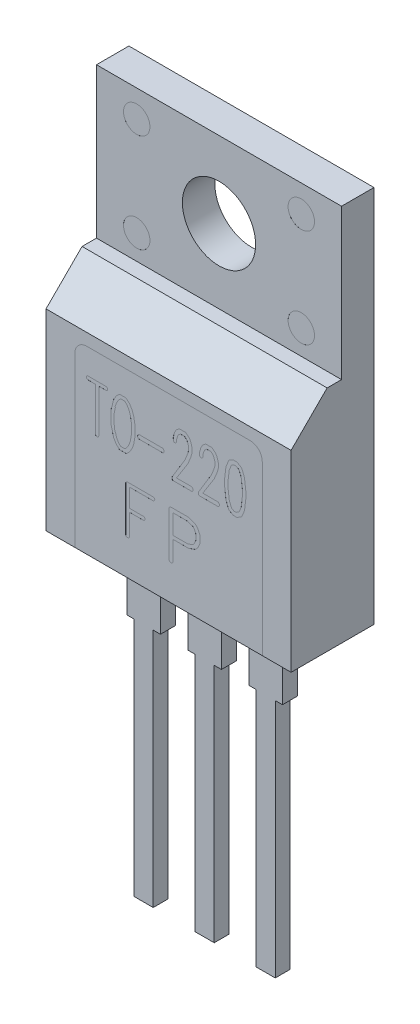
from build123d import *

# Parameters (mm, degrees)
SKETCH1_W           = 10.2
SKETCH1_H           = 15.75
SKETCH1_R           = 1.525
BOSS_EXTRUDE1_DEPTH = 1.35
SKETCH2_W           = 10.2
SKETCH2_H           = 9.5
BOSS_EXTRUDE2_DEPTH = 2.1
CHAMFER1_SIZE       = 1.5
CUT_EXTRUDE1_DEPTH  = 0.001
SKETCH4_W           = 1.4
SKETCH4_H           = 0.62
BOSS_EXTRUDE3_DEPTH = 2.85
SKETCH5_W           = 0.8
SKETCH5_H           = 0.62
BOSS_EXTRUDE4_DEPTH = 10
CUT_EXTRUDE2_DEPTH  = 0.001
SKETCH7_R           = 0.55
CUT_EXTRUDE3_DEPTH  = 0.001


with BuildPart() as part:
    # Sketch1 → Boss-Extrude1 (new body)
    with BuildSketch(Plane.XY):
        Rectangle(SKETCH1_W, SKETCH1_H)
        with Locations((0, 4.7)):
            Circle(SKETCH1_R, mode=Mode.SUBTRACT)
    extrude(amount=BOSS_EXTRUDE1_DEPTH)

    # Sketch2 → Boss-Extrude2 (add)
    with BuildSketch(Plane.XY.offset(1.35)):
        with Locations((0, -3.125)):
            Rectangle(SKETCH2_W, SKETCH2_H)
    extrude(amount=BOSS_EXTRUDE2_DEPTH)

    # Chamfer1
    chamfer1_edges = [part.edges().sort_by_distance(p)[0] for p in [
        (0, 1.625, 3.45),
    ]]
    chamfer(chamfer1_edges, length=CHAMFER1_SIZE)

    # Sketch3 → Cut-Extrude1 (cut)
    with BuildSketch(Plane.XY.offset(3.45)):
        with BuildLine():
            Line((-3.9, -7.875), (3.9, -7.875))
            Line((3.9, -7.875), (3.9, -0.875))
            ThreePointArc((3.9, -0.875), (3.753553391, -0.521446609), (3.4, -0.375))
            Line((3.4, -0.375), (-3.4, -0.375))
            ThreePointArc((-3.4, -0.375), (-3.753553391, -0.521446609), (-3.9, -0.875))
            Line((-3.9, -0.875), (-3.9, -7.875))
        make_face()
    extrude(amount=-CUT_EXTRUDE1_DEPTH, mode=Mode.SUBTRACT)

    # Sketch4 → Boss-Extrude3 (add)
    with BuildSketch(Plane.XZ.offset(7.875)):
        with Locations((-2.54, 1.639)):
            Rectangle(SKETCH4_W, SKETCH4_H)
        with Locations((0, 1.639)):
            Rectangle(SKETCH4_W, SKETCH4_H)
        with Locations((2.54, 1.639)):
            Rectangle(SKETCH4_W, SKETCH4_H)
    extrude(amount=BOSS_EXTRUDE3_DEPTH)

    # Sketch5 → Boss-Extrude4 (add)
    with BuildSketch(Plane.XZ.offset(10.725)):
        with Locations((-2.54, 1.639)):
            Rectangle(SKETCH5_W, SKETCH5_H)
        with Locations((2.54, 1.639)):
            Rectangle(SKETCH5_W, SKETCH5_H)
        with Locations((0, 1.639)):
            Rectangle(SKETCH5_W, SKETCH5_H)
    extrude(amount=BOSS_EXTRUDE4_DEPTH)

    # Sketch6 → Cut-Extrude2 (cut)
    # profile 1 of 8: a face of its own
    with BuildSketch(Plane.XY.offset(3.449)):
        with BuildLine():
            add(Edge.make_bspline(
                [(-3.337053571, -1.553571429), (-3.344583859, -1.555083796), (-3.358084631, -1.557795263), (-3.376927269, -1.557912121), (-3.392215813, -1.553387595), (-3.405362186, -1.540412883), (-3.414351272, -1.519967594), (-3.41589508, -1.502685243), (-3.416666667, -1.494047619)],
                knots=[0, 0, 0, 0, 1.138141606, 2.040531624, 2.780009125, 3.431502412, 4.71627916, 6, 6, 6, 6], degree=3))
            add(Edge.make_bspline(
                [(-3.416666667, -1.494047619), (-3.415955255, -1.485487162), (-3.414521596, -1.468235861), (-3.404666849, -1.448597093), (-3.394260846, -1.435081439), (-3.38431118, -1.427810635), (-3.37298055, -1.423460993), (-3.36499444, -1.422906102), (-3.360863095, -1.422619048)],
                knots=[0, 0, 0, 0, 1.528507809, 3.080296578, 3.85483527, 4.570982135, 5.260745705, 6, 6, 6, 6], degree=3))
            Line((-3.360863095, -1.422619048), (-2.613467262, -1.422619048))
            add(Edge.make_bspline(
                [(-2.613467262, -1.422619048), (-2.606485162, -1.422815125), (-2.59355828, -1.423178148), (-2.575825567, -1.428053473), (-2.561244351, -1.436313287), (-2.548533817, -1.451534048), (-2.537353697, -1.470515), (-2.535182119, -1.48685483), (-2.53422619, -1.494047619)],
                knots=[0, 0, 0, 0, 1.05057451, 1.945067327, 2.750578307, 3.532262753, 4.913702687, 6, 6, 6, 6], degree=3))
            add(Edge.make_bspline(
                [(-2.53422619, -1.494047619), (-2.535175637, -1.501359799), (-2.537312403, -1.517816137), (-2.548355556, -1.536974442), (-2.56138378, -1.551775043), (-2.575807789, -1.560057824), (-2.593563867, -1.564912043), (-2.606487122, -1.565278344), (-2.613467262, -1.56547619)],
                knots=[0, 0, 0, 0, 1.103831219, 2.484213998, 3.251526589, 4.056421147, 4.950229448, 6, 6, 6, 6], degree=3))
            Line((-2.613467262, -1.56547619), (-2.904761905, -1.56547619))
            Line((-2.904761905, -1.56547619), (-2.904761905, -3.345238095))
            add(Edge.make_bspline(
                [(-2.904761905, -3.345238095), (-2.905783203, -3.353312761), (-2.908067564, -3.371373542), (-2.920112704, -3.39210117), (-2.93369168, -3.4082686), (-2.948913179, -3.41688488), (-2.967479812, -3.421576529), (-2.980872483, -3.422253794), (-2.988095238, -3.422619048)],
                knots=[0, 0, 0, 0, 1.142200586, 2.554785099, 3.31231341, 4.106525294, 4.978836614, 6, 6, 6, 6], degree=3))
            add(Edge.make_bspline(
                [(-2.988095238, -3.422619048), (-2.992477514, -3.422356854), (-3.000994974, -3.421847252), (-3.012982756, -3.417136995), (-3.023333729, -3.409295729), (-3.035092846, -3.395314638), (-3.0451181, -3.373493005), (-3.046786339, -3.354645774), (-3.047619048, -3.345238095)],
                knots=[0, 0, 0, 0, 0.726822302, 1.412663379, 2.105912496, 2.866784857, 4.436041716, 6, 6, 6, 6], degree=3))
            Line((-3.047619048, -3.345238095), (-3.047619048, -1.56547619))
            Line((-3.047619048, -1.56547619), (-3.313244048, -1.56547619))
            Line((-3.313244048, -1.56547619), (-3.337053571, -1.553571429))
        make_face()
    # profile 2 of 8: a face of its own
    with BuildSketch(Plane.XY.offset(3.449)):
        with BuildLine():
            add(Edge.make_bspline(
                [(-1.52641369, -1.713541667), (-1.521569557, -1.721139903), (-1.513281033, -1.734140818), (-1.509417878, -1.749023616), (-1.5078125, -1.755208333)],
                knots=[0, 0, 0, 0, 1.168877111, 2, 2, 2, 2], degree=3))
            Line((-1.5078125, -1.755208333), (-1.45610119, -1.905505952))
            Line((-1.45610119, -1.905505952), (-1.453869048, -1.909970238))
            add(Edge.make_bspline(
                [(-1.453869048, -1.909970238), (-1.452063818, -1.915881011), (-1.449118709, -1.925524034), (-1.447715658, -1.935499284), (-1.447172619, -1.939360119)],
                knots=[0, 0, 0, 0, 1.225917069, 2, 2, 2, 2], degree=3))
            Line((-1.447172619, -1.939360119), (-1.405133929, -2.181547619))
            add(Edge.make_bspline(
                [(-1.405133929, -2.181547619), (-1.404978098, -2.186383521), (-1.404674476, -2.195805821), (-1.404733281, -2.205232768), (-1.404761905, -2.209821429)],
                knots=[0, 0, 0, 0, 1.026479987, 2, 2, 2, 2], degree=3))
            Line((-1.404761905, -2.209821429), (-1.404761905, -2.635416667))
            add(Edge.make_bspline(
                [(-1.404761905, -2.635416667), (-1.404761905, -2.640252976), (-1.404761905, -2.648933532), (-1.404761905, -2.657614087), (-1.404761905, -2.661458333)],
                knots=[0, 0, 0, 0, 1.114285714, 2, 2, 2, 2], degree=3))
            Line((-1.404761905, -2.661458333), (-1.447544643, -2.911458333))
            add(Edge.make_bspline(
                [(-1.447544643, -2.911458333), (-1.448071758, -2.915076164), (-1.44923368, -2.923050959), (-1.451750148, -2.930710891), (-1.453125, -2.934895833)],
                knots=[0, 0, 0, 0, 0.907316161, 2, 2, 2, 2], degree=3))
            Line((-1.453125, -2.934895833), (-1.453497024, -2.936755952))
            Line((-1.453497024, -2.936755952), (-1.509672619, -3.099702381))
            add(Edge.make_bspline(
                [(-1.509672619, -3.099702381), (-1.511691149, -3.105142077), (-1.515068691, -3.114244148), (-1.520240473, -3.122444496), (-1.522321429, -3.125744048)],
                knots=[0, 0, 0, 0, 1.195265482, 2, 2, 2, 2], degree=3))
            Line((-1.522321429, -3.125744048), (-1.624255952, -3.292782738))
            add(Edge.make_bspline(
                [(-1.624255952, -3.292782738), (-1.62723118, -3.299355902), (-1.632872287, -3.311818787), (-1.645210746, -3.317586696), (-1.651041667, -3.3203125)],
                knots=[0, 0, 0, 0, 1.054838137, 2, 2, 2, 2], degree=3))
            Line((-1.651041667, -3.3203125), (-1.73139881, -3.390625))
            add(Edge.make_bspline(
                [(-1.73139881, -3.390625), (-1.734537434, -3.395659865), (-1.740792772, -3.405694444), (-1.756766619, -3.415360622), (-1.775867415, -3.422082236), (-1.790225752, -3.422430629), (-1.797991071, -3.422619048)],
                knots=[0, 0, 0, 0, 0.90300958, 1.799714995, 2.810035161, 4, 4, 4, 4], degree=3))
            Line((-1.797991071, -3.422619048), (-2.022693452, -3.422619048))
            add(Edge.make_bspline(
                [(-2.022693452, -3.422619048), (-2.027709633, -3.422288731), (-2.037186463, -3.42166468), (-2.050112034, -3.416239842), (-2.060400224, -3.407172238), (-2.064716239, -3.399227431), (-2.066964286, -3.395089286)],
                knots=[0, 0, 0, 0, 1.085042538, 2.049918853, 2.984277492, 4, 4, 4, 4], degree=3))
            Line((-2.066964286, -3.395089286), (-2.147693452, -3.324404762))
            add(Edge.make_bspline(
                [(-2.147693452, -3.324404762), (-2.150402352, -3.323464237), (-2.156134086, -3.321474188), (-2.163143173, -3.314428255), (-2.169950469, -3.30551817), (-2.173379568, -3.29820353), (-2.175223214, -3.294270833)],
                knots=[0, 0, 0, 0, 0.807126528, 1.707791034, 2.767600087, 4, 4, 4, 4], degree=3))
            Line((-2.175223214, -3.294270833), (-2.2734375, -3.133928571))
            add(Edge.make_bspline(
                [(-2.2734375, -3.133928571), (-2.277965155, -3.127710393), (-2.287061572, -3.115217583), (-2.289384089, -3.099936815), (-2.290550595, -3.092261905)],
                knots=[0, 0, 0, 0, 0.995481035, 2, 2, 2, 2], degree=3))
            Line((-2.290550595, -3.092261905), (-2.33296131, -2.939360119))
            add(Edge.make_bspline(
                [(-2.33296131, -2.939360119), (-2.333116325, -2.934648225), (-2.333426302, -2.925226069), (-2.333364319, -2.915799019), (-2.333333333, -2.91108631)],
                knots=[0, 0, 0, 0, 1.00017307, 2, 2, 2, 2], degree=3))
            Line((-2.333333333, -2.91108631), (-2.404389881, -2.668526786))
            add(Edge.make_bspline(
                [(-2.404389881, -2.668526786), (-2.404543154, -2.663318801), (-2.404867897, -2.652284484), (-2.404798531, -2.641245476), (-2.404761905, -2.635416667)],
                knots=[0, 0, 0, 0, 0.943961462, 2, 2, 2, 2], degree=3))
            Line((-2.404761905, -2.635416667), (-2.404761905, -2.209821429))
            add(Edge.make_bspline(
                [(-2.404761905, -2.209821429), (-2.404761905, -2.204985119), (-2.404761905, -2.194816468), (-2.404761905, -2.184647817), (-2.404761905, -2.179315476)],
                knots=[0, 0, 0, 0, 0.951219512, 2, 2, 2, 2], degree=3))
            Line((-2.404761905, -2.179315476), (-2.33296131, -1.937872024))
            add(Edge.make_bspline(
                [(-2.33296131, -1.937872024), (-2.333114363, -1.933284123), (-2.333441089, -1.923490235), (-2.333370732, -1.913690981), (-2.333333333, -1.908482143)],
                knots=[0, 0, 0, 0, 0.93689068, 2, 2, 2, 2], degree=3))
            Line((-2.333333333, -1.908482143), (-2.290550595, -1.754092262))
            add(Edge.make_bspline(
                [(-2.290550595, -1.754092262), (-2.289422524, -1.746157998), (-2.287235218, -1.730773621), (-2.278189869, -1.718161284), (-2.273809524, -1.712053571)],
                knots=[0, 0, 0, 0, 1.031470231, 2, 2, 2, 2], degree=3))
            Line((-2.273809524, -1.712053571), (-2.175967262, -1.552455357))
            add(Edge.make_bspline(
                [(-2.175967262, -1.552455357), (-2.172375166, -1.546111687), (-2.165712415, -1.534345214), (-2.15388732, -1.527897258), (-2.1484375, -1.524925595)],
                knots=[0, 0, 0, 0, 1.078261996, 2, 2, 2, 2], degree=3))
            Line((-2.1484375, -1.524925595), (-2.066964286, -1.450892857))
            add(Edge.make_bspline(
                [(-2.066964286, -1.450892857), (-2.064713149, -1.44664404), (-2.06039779, -1.438499187), (-2.050242823, -1.428969593), (-2.0371713, -1.423591128), (-2.027704385, -1.422955495), (-2.022693452, -1.422619048)],
                knots=[0, 0, 0, 0, 1.028115026, 1.970864985, 2.925958555, 4, 4, 4, 4], degree=3))
            Line((-2.022693452, -1.422619048), (-1.797991071, -1.422619048))
            add(Edge.make_bspline(
                [(-1.797991071, -1.422619048), (-1.79025041, -1.423007995), (-1.775829214, -1.423732621), (-1.756042842, -1.43003755), (-1.740139164, -1.441146508), (-1.733568214, -1.451612328), (-1.730282738, -1.456845238)],
                knots=[0, 0, 0, 0, 1.159625116, 2.160432893, 3.080216446, 4, 4, 4, 4], degree=3))
            Line((-1.730282738, -1.456845238), (-1.66108631, -1.525297619))
            add(Edge.make_bspline(
                [(-1.66108631, -1.525297619), (-1.653708193, -1.528191047), (-1.639575934, -1.533733203), (-1.630216935, -1.545645917), (-1.625744048, -1.551339286)],
                knots=[0, 0, 0, 0, 1.044152526, 2, 2, 2, 2], degree=3))
            Line((-1.625744048, -1.551339286), (-1.52641369, -1.713541667))
        make_face()
        Polygon((-1.735491071, -3.196800595), (-1.647693452, -3.049479167), (-1.593377976, -2.889508929), (-1.592633929, -2.88764881), (-1.547619048, -2.625744048), (-1.547619048, -2.219122024), (-1.59077381, -1.963169643), (-1.592261905, -1.962797619), (-1.647693452, -1.796130952), (-1.735863095, -1.648065476), (-1.82328869, -1.56547619), (-1.99516369, -1.56547619), (-2.073660714, -1.640997024), (-2.161458333, -1.788690476), (-2.230654762, -1.97172619), (-2.212425595, -1.980282738), (-2.261904762, -2.216145833), (-2.261904762, -2.629464286), (-2.231770833, -2.874627976), (-2.212797619, -2.864955357), (-2.16108631, -3.05766369), (-2.07328869, -3.204985119), (-1.99516369, -3.279761905), (-1.822916667, -3.279761905), align=None, mode=Mode.SUBTRACT)
    # profile 3 of 8: a face of its own
    with BuildSketch(Plane.XY.offset(3.449)):
        with BuildLine():
            add(Edge.make_bspline(
                [(-0.242559524, -2.470238095), (-0.236737568, -2.474185635), (-0.226183932, -2.481341459), (-0.213272553, -2.493136944), (-0.203729622, -2.504047557), (-0.200480381, -2.512056677), (-0.199032738, -2.515625)],
                knots=[0, 0, 0, 0, 1.31724091, 2.387802413, 3.2817136, 4, 4, 4, 4], degree=3))
            add(Edge.make_bspline(
                [(-0.199032738, -2.515625), (-0.196583303, -2.521121284), (-0.191620176, -2.532258038), (-0.190860796, -2.544430307), (-0.19047619, -2.550595238)],
                knots=[0, 0, 0, 0, 0.987053187, 2, 2, 2, 2], degree=3))
            add(Edge.make_bspline(
                [(-0.19047619, -2.550595238), (-0.19091643, -2.557681294), (-0.191839981, -2.572546708), (-0.196058783, -2.591268526), (-0.203257081, -2.606628522), (-0.213554845, -2.617296254), (-0.227165503, -2.627886404), (-0.238106154, -2.633730856), (-0.244047619, -2.636904762)],
                knots=[0, 0, 0, 0, 1.174378568, 2.463658788, 3.152065413, 3.951460674, 4.88751369, 6, 6, 6, 6], degree=3))
            Line((-0.244047619, -2.636904762), (-1.241071429, -2.636532738))
            add(Edge.make_bspline(
                [(-1.241071429, -2.636532738), (-1.24734748, -2.634300762), (-1.259764182, -2.629884964), (-1.273213436, -2.613896934), (-1.282931233, -2.593493896), (-1.284733205, -2.577520886), (-1.285714286, -2.568824405)],
                knots=[0, 0, 0, 0, 0.906075189, 1.792602544, 2.798185721, 4, 4, 4, 4], degree=3))
            add(Edge.make_bspline(
                [(-1.285714286, -2.568824405), (-1.285451022, -2.55972433), (-1.284953893, -2.542540389), (-1.278797169, -2.518739719), (-1.269464146, -2.498196875), (-1.259605446, -2.487878439), (-1.25483631, -2.482886905)],
                knots=[0, 0, 0, 0, 1.159043221, 2.188655717, 3.123763861, 4, 4, 4, 4], degree=3))
            add(Edge.make_bspline(
                [(-1.25483631, -2.482886905), (-1.253129302, -2.481118925), (-1.248728791, -2.476561234), (-1.243748056, -2.472638907), (-1.240699405, -2.470238095)],
                knots=[0, 0, 0, 0, 0.775822661, 2, 2, 2, 2], degree=3))
            Line((-1.240699405, -2.470238095), (-0.242559524, -2.470238095))
        make_face()
    # profile 4 of 8: a face of its own
    with BuildSketch(Plane.XY.offset(3.449)):
        with BuildLine():
            add(Edge.make_bspline(
                [(0.712797619, -1.425967262), (0.721071724, -1.432830569), (0.739542685, -1.448152091), (0.771108883, -1.472560513), (0.80836802, -1.501946549), (0.835535865, -1.522731405), (0.850074405, -1.533854167)],
                knots=[0, 0, 0, 0, 0.738755888, 1.649185221, 2.741990243, 4, 4, 4, 4], degree=3))
            add(Edge.make_bspline(
                [(0.850074405, -1.533854167), (0.857193904, -1.544858282), (0.873047273, -1.569361735), (0.892477062, -1.601527844), (0.908350096, -1.629507045), (0.918728797, -1.650289613), (0.925710778, -1.670383689), (0.928912669, -1.683506895), (0.930431548, -1.689732143)],
                knots=[0, 0, 0, 0, 1.337769255, 2.978882237, 3.834564883, 4.621482691, 5.346073539, 6, 6, 6, 6], degree=3))
            add(Edge.make_bspline(
                [(0.930431548, -1.689732143), (0.933181977, -1.698157575), (0.939596437, -1.717807084), (0.949886734, -1.751418374), (0.962103289, -1.793424669), (0.971211364, -1.824038271), (0.976190476, -1.84077381)],
                knots=[0, 0, 0, 0, 0.673862802, 1.571560152, 2.672444651, 4, 4, 4, 4], degree=3))
            Line((0.976190476, -1.84077381), (0.976190476, -2.039434524))
            add(Edge.make_bspline(
                [(0.976190476, -2.039434524), (0.975101474, -2.043286997), (0.972561426, -2.052272711), (0.967474239, -2.067373762), (0.962215138, -2.086520139), (0.954811778, -2.109036734), (0.94732854, -2.13562538), (0.93777712, -2.16548407), (0.927877074, -2.199333473), (0.92054654, -2.222977084), (0.916666667, -2.235491071)],
                knots=[0, 0, 0, 0, 0.468874405, 1.093627666, 1.865790236, 2.793814149, 3.869268999, 5.100575786, 6.465405363, 8, 8, 8, 8], degree=3))
            Line((0.916666667, -2.235491071), (0.802455357, -2.5078125))
            Line((0.802455357, -2.5078125), (0.329241071, -3.255952381))
            Line((0.329241071, -3.255952381), (0.962425595, -3.255952381))
            add(Edge.make_bspline(
                [(0.962425595, -3.255952381), (0.971316041, -3.261097314), (0.987996452, -3.270750327), (1.006936243, -3.291269739), (1.019316901, -3.314861065), (1.020323936, -3.332069239), (1.020833333, -3.34077381)],
                knots=[0, 0, 0, 0, 1.127991252, 2.116356953, 3.047179272, 4, 4, 4, 4], degree=3))
            add(Edge.make_bspline(
                [(1.020833333, -3.34077381), (1.019685126, -3.34761406), (1.016927856, -3.364040038), (1.012581216, -3.380123237), (1.010044643, -3.389508929)],
                knots=[0, 0, 0, 0, 0.832857648, 2, 2, 2, 2], degree=3))
            add(Edge.make_bspline(
                [(1.010044643, -3.389508929), (1.00702498, -3.394628813), (1.00094897, -3.404930779), (0.985445664, -3.415491928), (0.966324226, -3.421430631), (0.952430831, -3.422202766), (0.944940476, -3.422619048)],
                knots=[0, 0, 0, 0, 0.915320197, 1.841760097, 2.836426763, 4, 4, 4, 4], degree=3))
            Line((0.944940476, -3.422619048), (0.183407738, -3.422619048))
            add(Edge.make_bspline(
                [(0.183407738, -3.422619048), (0.177812532, -3.419610613), (0.166502935, -3.413529661), (0.15382021, -3.397462926), (0.145616222, -3.376553009), (0.143826435, -3.360824571), (0.142857143, -3.352306548)],
                knots=[0, 0, 0, 0, 0.883706095, 1.786236404, 2.801095743, 4, 4, 4, 4], degree=3))
            add(Edge.make_bspline(
                [(0.142857143, -3.352306548), (0.143495797, -3.339805127), (0.14473152, -3.315616334), (0.155507583, -3.293950493), (0.160714286, -3.283482143)],
                knots=[0, 0, 0, 0, 1.033653998, 2, 2, 2, 2], degree=3))
            Line((0.160714286, -3.283482143), (0.686383929, -2.420386905))
            Line((0.686383929, -2.420386905), (0.7890625, -2.162946429))
            Line((0.7890625, -2.162946429), (0.833333333, -2.018229167))
            Line((0.833333333, -2.018229167), (0.833333333, -1.876488095))
            Line((0.833333333, -1.876488095), (0.786458333, -1.725446429))
            Line((0.786458333, -1.725446429), (0.747395833, -1.658482143))
            Line((0.747395833, -1.658482143), (0.659970238, -1.589285714))
            Line((0.659970238, -1.589285714), (0.494791667, -1.589285714))
            Line((0.494791667, -1.589285714), (0.419270833, -1.651785714))
            Line((0.419270833, -1.651785714), (0.380580357, -1.716517857))
            Line((0.380580357, -1.716517857), (0.334077381, -1.870907738))
            Line((0.334077381, -1.870907738), (0.334077381, -1.933779762))
            add(Edge.make_bspline(
                [(0.334077381, -1.933779762), (0.33374097, -1.941420313), (0.333078192, -1.956473288), (0.324971687, -1.977704016), (0.312989948, -1.997361234), (0.301628556, -2.007931796), (0.295758929, -2.013392857)],
                knots=[0, 0, 0, 0, 0.999430391, 1.969020288, 2.950736492, 4, 4, 4, 4], degree=3))
            add(Edge.make_bspline(
                [(0.295758929, -2.013392857), (0.288121108, -2.015733333), (0.274584737, -2.019881316), (0.260570896, -2.021839961), (0.254464286, -2.022693452)],
                knots=[0, 0, 0, 0, 1.128488755, 2, 2, 2, 2], degree=3))
            add(Edge.make_bspline(
                [(0.254464286, -2.022693452), (0.249953065, -2.022589007), (0.24145158, -2.022392177), (0.229993388, -2.018027853), (0.220377992, -2.011539361), (0.216096978, -2.005375611), (0.21391369, -2.002232143)],
                knots=[0, 0, 0, 0, 1.128025163, 2.125785883, 3.044164124, 4, 4, 4, 4], degree=3))
            add(Edge.make_bspline(
                [(0.21391369, -2.002232143), (0.21064577, -1.997532578), (0.203427027, -1.987151375), (0.198528698, -1.966577558), (0.193961069, -1.941806715), (0.193872773, -1.923401051), (0.193824405, -1.913318452)],
                knots=[0, 0, 0, 0, 0.735272304, 1.624195484, 2.698537447, 4, 4, 4, 4], degree=3))
            add(Edge.make_bspline(
                [(0.193824405, -1.913318452), (0.195254151, -1.912473433), (0.19795684, -1.91087607), (0.199049327, -1.905696939), (0.197629034, -1.899908841), (0.195211492, -1.896137218), (0.193824405, -1.893973214)],
                knots=[0, 0, 0, 0, 0.85238152, 1.611280165, 2.62944954, 4, 4, 4, 4], degree=3))
            add(Edge.make_bspline(
                [(0.193824405, -1.893973214), (0.194258055, -1.884178191), (0.195081201, -1.865585514), (0.195238208, -1.8469755), (0.1953125, -1.838169643)],
                knots=[0, 0, 0, 0, 1.053643116, 2, 2, 2, 2], degree=3))
            add(Edge.make_bspline(
                [(0.1953125, -1.838169643), (0.199165068, -1.825399317), (0.207652386, -1.797265926), (0.221290486, -1.751345048), (0.237356592, -1.697880712), (0.248990254, -1.659840861), (0.255208333, -1.639508929)],
                knots=[0, 0, 0, 0, 0.771421305, 1.699463078, 2.770385237, 4, 4, 4, 4], degree=3))
            add(Edge.make_bspline(
                [(0.255208333, -1.639508929), (0.262582703, -1.626449449), (0.276848727, -1.601185346), (0.291856948, -1.576355137), (0.299107143, -1.564360119)],
                knots=[0, 0, 0, 0, 1.033836784, 2, 2, 2, 2], degree=3))
            add(Edge.make_bspline(
                [(0.299107143, -1.564360119), (0.304066946, -1.55657992), (0.313257967, -1.542162417), (0.327603119, -1.523709927), (0.340881795, -1.50934686), (0.350804323, -1.503419356), (0.355282738, -1.500744048)],
                knots=[0, 0, 0, 0, 1.289706312, 2.389957182, 3.273326239, 4, 4, 4, 4], degree=3))
            Line((0.355282738, -1.500744048), (0.445684524, -1.428943452))
            Line((0.445684524, -1.428943452), (0.462053571, -1.422991071))
            Line((0.462053571, -1.422991071), (0.712797619, -1.425967262))
        make_face()
    # profile 5 of 8: a face of its own
    with BuildSketch(Plane.XY.offset(3.449)):
        with BuildLine():
            add(Edge.make_bspline(
                [(1.808035714, -1.425967262), (1.816309819, -1.432830569), (1.83478078, -1.448152091), (1.866346978, -1.472560513), (1.903606116, -1.501946549), (1.93077396, -1.522731405), (1.9453125, -1.533854167)],
                knots=[0, 0, 0, 0, 0.738755888, 1.649185221, 2.741990243, 4, 4, 4, 4], degree=3))
            add(Edge.make_bspline(
                [(1.9453125, -1.533854167), (1.952431999, -1.544858282), (1.968285368, -1.569361735), (1.987715157, -1.601527844), (2.003588191, -1.629507045), (2.013966892, -1.650289613), (2.020948873, -1.670383689), (2.024150764, -1.683506895), (2.025669643, -1.689732143)],
                knots=[0, 0, 0, 0, 1.337769255, 2.978882237, 3.834564883, 4.621482691, 5.346073539, 6, 6, 6, 6], degree=3))
            add(Edge.make_bspline(
                [(2.025669643, -1.689732143), (2.028420073, -1.698157575), (2.034834533, -1.717807084), (2.045124829, -1.751418374), (2.057341385, -1.793424669), (2.06644946, -1.824038271), (2.071428571, -1.84077381)],
                knots=[0, 0, 0, 0, 0.673862802, 1.571560152, 2.672444651, 4, 4, 4, 4], degree=3))
            Line((2.071428571, -1.84077381), (2.071428571, -2.039434524))
            add(Edge.make_bspline(
                [(2.071428571, -2.039434524), (2.070339569, -2.043286997), (2.067799522, -2.052272711), (2.062712334, -2.067373762), (2.057453234, -2.086520139), (2.050049873, -2.109036734), (2.042566636, -2.13562538), (2.033015215, -2.16548407), (2.023115169, -2.199333473), (2.015784635, -2.222977084), (2.011904762, -2.235491071)],
                knots=[0, 0, 0, 0, 0.468874405, 1.093627666, 1.865790236, 2.793814149, 3.869268999, 5.100575786, 6.465405363, 8, 8, 8, 8], degree=3))
            Line((2.011904762, -2.235491071), (1.897693452, -2.5078125))
            Line((1.897693452, -2.5078125), (1.424479167, -3.255952381))
            Line((1.424479167, -3.255952381), (2.05766369, -3.255952381))
            add(Edge.make_bspline(
                [(2.05766369, -3.255952381), (2.066554137, -3.261097314), (2.083234548, -3.270750327), (2.102174338, -3.291269739), (2.114554997, -3.314861065), (2.115562031, -3.332069239), (2.116071429, -3.34077381)],
                knots=[0, 0, 0, 0, 1.127991252, 2.116356953, 3.047179272, 4, 4, 4, 4], degree=3))
            add(Edge.make_bspline(
                [(2.116071429, -3.34077381), (2.114923222, -3.34761406), (2.112165951, -3.364040038), (2.107819312, -3.380123237), (2.105282738, -3.389508929)],
                knots=[0, 0, 0, 0, 0.832857648, 2, 2, 2, 2], degree=3))
            add(Edge.make_bspline(
                [(2.105282738, -3.389508929), (2.102263075, -3.394628813), (2.096187066, -3.404930779), (2.080683759, -3.415491928), (2.061562321, -3.421430631), (2.047668926, -3.422202766), (2.040178571, -3.422619048)],
                knots=[0, 0, 0, 0, 0.915320197, 1.841760097, 2.836426763, 4, 4, 4, 4], degree=3))
            Line((2.040178571, -3.422619048), (1.278645833, -3.422619048))
            add(Edge.make_bspline(
                [(1.278645833, -3.422619048), (1.273050627, -3.419610613), (1.26174103, -3.413529661), (1.249058306, -3.397462926), (1.240854317, -3.376553009), (1.23906453, -3.360824571), (1.238095238, -3.352306548)],
                knots=[0, 0, 0, 0, 0.883706095, 1.786236404, 2.801095743, 4, 4, 4, 4], degree=3))
            add(Edge.make_bspline(
                [(1.238095238, -3.352306548), (1.238733893, -3.339805127), (1.239969615, -3.315616334), (1.250745678, -3.293950493), (1.255952381, -3.283482143)],
                knots=[0, 0, 0, 0, 1.033653998, 2, 2, 2, 2], degree=3))
            Line((1.255952381, -3.283482143), (1.781622024, -2.420386905))
            Line((1.781622024, -2.420386905), (1.884300595, -2.162946429))
            Line((1.884300595, -2.162946429), (1.928571429, -2.018229167))
            Line((1.928571429, -2.018229167), (1.928571429, -1.876488095))
            Line((1.928571429, -1.876488095), (1.881696429, -1.725446429))
            Line((1.881696429, -1.725446429), (1.842633929, -1.658482143))
            Line((1.842633929, -1.658482143), (1.755208333, -1.589285714))
            Line((1.755208333, -1.589285714), (1.590029762, -1.589285714))
            Line((1.590029762, -1.589285714), (1.514508929, -1.651785714))
            Line((1.514508929, -1.651785714), (1.475818452, -1.716517857))
            Line((1.475818452, -1.716517857), (1.429315476, -1.870907738))
            Line((1.429315476, -1.870907738), (1.429315476, -1.933779762))
            add(Edge.make_bspline(
                [(1.429315476, -1.933779762), (1.428979065, -1.941420313), (1.428316287, -1.956473288), (1.420209782, -1.977704016), (1.408228044, -1.997361234), (1.396866651, -2.007931796), (1.390997024, -2.013392857)],
                knots=[0, 0, 0, 0, 0.999430391, 1.969020288, 2.950736492, 4, 4, 4, 4], degree=3))
            add(Edge.make_bspline(
                [(1.390997024, -2.013392857), (1.383359203, -2.015733333), (1.369822832, -2.019881316), (1.355808991, -2.021839961), (1.349702381, -2.022693452)],
                knots=[0, 0, 0, 0, 1.128488755, 2, 2, 2, 2], degree=3))
            add(Edge.make_bspline(
                [(1.349702381, -2.022693452), (1.34519116, -2.022589007), (1.336689675, -2.022392177), (1.325231484, -2.018027853), (1.315616088, -2.011539361), (1.311335073, -2.005375611), (1.309151786, -2.002232143)],
                knots=[0, 0, 0, 0, 1.128025163, 2.125785883, 3.044164124, 4, 4, 4, 4], degree=3))
            add(Edge.make_bspline(
                [(1.309151786, -2.002232143), (1.305883865, -1.997532578), (1.298665123, -1.987151375), (1.293766793, -1.966577558), (1.289199165, -1.941806715), (1.289110868, -1.923401051), (1.2890625, -1.913318452)],
                knots=[0, 0, 0, 0, 0.735272304, 1.624195484, 2.698537447, 4, 4, 4, 4], degree=3))
            add(Edge.make_bspline(
                [(1.2890625, -1.913318452), (1.290492246, -1.912473433), (1.293194935, -1.91087607), (1.294287422, -1.905696939), (1.292867129, -1.899908841), (1.290449587, -1.896137218), (1.2890625, -1.893973214)],
                knots=[0, 0, 0, 0, 0.85238152, 1.611280165, 2.62944954, 4, 4, 4, 4], degree=3))
            add(Edge.make_bspline(
                [(1.2890625, -1.893973214), (1.289496151, -1.884178191), (1.290319296, -1.865585514), (1.290476303, -1.8469755), (1.290550595, -1.838169643)],
                knots=[0, 0, 0, 0, 1.053643116, 2, 2, 2, 2], degree=3))
            add(Edge.make_bspline(
                [(1.290550595, -1.838169643), (1.294403163, -1.825399317), (1.302890481, -1.797265926), (1.316528581, -1.751345048), (1.332594688, -1.697880712), (1.344228349, -1.659840861), (1.350446429, -1.639508929)],
                knots=[0, 0, 0, 0, 0.771421305, 1.699463078, 2.770385237, 4, 4, 4, 4], degree=3))
            add(Edge.make_bspline(
                [(1.350446429, -1.639508929), (1.357820799, -1.626449449), (1.372086822, -1.601185346), (1.387095043, -1.576355137), (1.394345238, -1.564360119)],
                knots=[0, 0, 0, 0, 1.033836784, 2, 2, 2, 2], degree=3))
            add(Edge.make_bspline(
                [(1.394345238, -1.564360119), (1.399305042, -1.55657992), (1.408496063, -1.542162417), (1.422841214, -1.523709927), (1.43611989, -1.50934686), (1.446042418, -1.503419356), (1.450520833, -1.500744048)],
                knots=[0, 0, 0, 0, 1.289706312, 2.389957182, 3.273326239, 4, 4, 4, 4], degree=3))
            Line((1.450520833, -1.500744048), (1.540922619, -1.428943452))
            Line((1.540922619, -1.428943452), (1.557291667, -1.422991071))
            Line((1.557291667, -1.422991071), (1.808035714, -1.425967262))
        make_face()
    # profile 6 of 8: a face of its own
    with BuildSketch(Plane.XY.offset(3.449)):
        with BuildLine():
            add(Edge.make_bspline(
                [(2.84375, -1.425967262), (2.855004825, -1.432592189), (2.880325289, -1.447496572), (2.923386766, -1.471065428), (2.974951014, -1.499851499), (3.012501875, -1.520254688), (3.032738095, -1.53125)],
                knots=[0, 0, 0, 0, 0.724351583, 1.629604892, 2.722590218, 4, 4, 4, 4], degree=3))
            Line((3.032738095, -1.53125), (3.049479167, -1.558407738))
            Line((3.049479167, -1.558407738), (3.155505952, -1.824032738))
            Line((3.155505952, -1.824032738), (3.16108631, -1.847470238))
            Line((3.16108631, -1.847470238), (3.214285714, -2.294642857))
            Line((3.214285714, -2.294642857), (3.214285714, -2.563616071))
            Line((3.214285714, -2.563616071), (3.159598214, -3.017485119))
            Line((3.159598214, -3.017485119), (3.154017857, -3.032738095))
            Line((3.154017857, -3.032738095), (3.038690476, -3.307291667))
            Line((3.038690476, -3.307291667), (3.027901786, -3.319568452))
            add(Edge.make_bspline(
                [(3.027901786, -3.319568452), (3.012806082, -3.32670875), (2.979488491, -3.342468037), (2.938521858, -3.365945342), (2.904358897, -3.385858428), (2.880873498, -3.399754931), (2.860294748, -3.411583428), (2.847708481, -3.419130196), (2.841889881, -3.422619048)],
                knots=[0, 0, 0, 0, 1.412396496, 3.117287638, 3.991835281, 4.758389455, 5.426006563, 6, 6, 6, 6], degree=3))
            Line((2.841889881, -3.422619048), (2.693452381, -3.422619048))
            add(Edge.make_bspline(
                [(2.693452381, -3.422619048), (2.681887414, -3.416602255), (2.656484227, -3.403385988), (2.615592762, -3.380299229), (2.567524884, -3.353748356), (2.533449878, -3.334134827), (2.515252976, -3.323660714)],
                knots=[0, 0, 0, 0, 0.767374702, 1.68558742, 2.764045988, 4, 4, 4, 4], degree=3))
            Line((2.515252976, -3.323660714), (2.499627976, -3.302455357))
            Line((2.499627976, -3.302455357), (2.390252976, -3.02641369))
            Line((2.390252976, -3.02641369), (2.386160714, -3.006696429))
            Line((2.386160714, -3.006696429), (2.333333333, -2.561011905))
            Line((2.333333333, -2.561011905), (2.333333333, -2.274181548))
            Line((2.333333333, -2.274181548), (2.386532738, -1.829241071))
            Line((2.386532738, -1.829241071), (2.392485119, -1.808779762))
            Line((2.392485119, -1.808779762), (2.503348214, -1.540922619))
            Line((2.503348214, -1.540922619), (2.518229167, -1.52046131))
            add(Edge.make_bspline(
                [(2.518229167, -1.52046131), (2.524327338, -1.517653754), (2.537630402, -1.511529115), (2.558693428, -1.50056682), (2.582994533, -1.488017901), (2.609148753, -1.473500395), (2.635414741, -1.458950164), (2.659842835, -1.445430504), (2.681241231, -1.433548805), (2.694685251, -1.426326075), (2.700892857, -1.422991071)],
                knots=[0, 0, 0, 0, 0.777935742, 1.697054373, 2.751299037, 3.947613068, 5.16345026, 6.231321251, 7.18333501, 8, 8, 8, 8], degree=3))
            Line((2.700892857, -1.422991071), (2.84375, -1.425967262))
        make_face()
        Polygon((2.930059524, -1.65625), (2.805803571, -1.589285714), (2.728422619, -1.589285714), (2.616815476, -1.651041667), (2.524553571, -1.87797619), (2.476190476, -2.283854167), (2.476190476, -2.550967262), (2.526785714, -2.96577381), (2.618303571, -3.194568452), (2.728050595, -3.255952381), (2.805059524, -3.255952381), (2.931547619, -3.184895833), (3.022693452, -2.960193452), (3.071428571, -2.54985119), (3.071428571, -2.305803571), (3.020833333, -1.882440476), align=None, mode=Mode.SUBTRACT)
    # profile 7 of 8: a face of its own
    with BuildSketch(Plane.XY.offset(3.449)):
        with BuildLine():
            add(Edge.make_bspline(
                [(-0.647172619, -4.42485119), (-0.636827041, -4.428043613), (-0.618321723, -4.433753954), (-0.595395896, -4.446830233), (-0.579271253, -4.46278168), (-0.576116477, -4.475936219), (-0.574627976, -4.482142857)],
                knots=[0, 0, 0, 0, 1.323785726, 2.367878737, 3.229924671, 4, 4, 4, 4], degree=3))
            add(Edge.make_bspline(
                [(-0.574627976, -4.482142857), (-0.57494562, -4.489051834), (-0.575574618, -4.502733008), (-0.584084811, -4.521787863), (-0.597154073, -4.538877003), (-0.60896128, -4.547528), (-0.615178571, -4.552083333)],
                knots=[0, 0, 0, 0, 0.974871495, 1.930443064, 2.910238585, 4, 4, 4, 4], degree=3))
            add(Edge.make_bspline(
                [(-0.615178571, -4.552083333), (-0.618058705, -4.554256112), (-0.624602148, -4.559192497), (-0.638698847, -4.562729694), (-0.656607616, -4.565280256), (-0.670218506, -4.565406821), (-0.677678571, -4.56547619)],
                knots=[0, 0, 0, 0, 0.659063234, 1.49734101, 2.628304186, 4, 4, 4, 4], degree=3))
            Line((-0.677678571, -4.56547619), (-1.616666667, -4.56547619))
            Line((-1.616666667, -4.56547619), (-1.616666667, -5.327380952))
            Line((-1.616666667, -5.327380952), (-1.043377976, -5.327380952))
            add(Edge.make_bspline(
                [(-1.043377976, -5.327380952), (-1.035997232, -5.33060539), (-1.022506618, -5.336499057), (-1.005152232, -5.346136806), (-0.991876039, -5.354722149), (-0.981763354, -5.366002943), (-0.974230796, -5.37935463), (-0.972663356, -5.390420796), (-0.971949405, -5.39546131)],
                knots=[0, 0, 0, 0, 1.385850027, 2.533073688, 3.421965961, 4.08717946, 5.128731831, 6, 6, 6, 6], degree=3))
            add(Edge.make_bspline(
                [(-0.971949405, -5.39546131), (-0.972603348, -5.402190327), (-0.97401364, -5.416702106), (-0.981871883, -5.429028927), (-0.98608631, -5.435639881)],
                knots=[0, 0, 0, 0, 0.927387056, 2, 2, 2, 2], degree=3))
            add(Edge.make_bspline(
                [(-0.98608631, -5.435639881), (-0.991988777, -5.440953178), (-1.003231171, -5.451073382), (-1.022169111, -5.462071391), (-1.041446477, -5.468784218), (-1.054490457, -5.469760925), (-1.060863095, -5.470238095)],
                knots=[0, 0, 0, 0, 1.126805387, 2.146219525, 3.094335219, 4, 4, 4, 4], degree=3))
            Line((-1.060863095, -5.470238095), (-1.616666667, -5.470238095))
            Line((-1.616666667, -5.470238095), (-1.616666667, -6.356026786))
            add(Edge.make_bspline(
                [(-1.616666667, -6.356026786), (-1.618668191, -6.362405572), (-1.622862531, -6.375772782), (-1.636885547, -6.393197488), (-1.655492782, -6.409674682), (-1.67088916, -6.418093087), (-1.679166667, -6.422619048)],
                knots=[0, 0, 0, 0, 0.845387553, 1.771571109, 2.801936792, 4, 4, 4, 4], degree=3))
            Line((-1.679166667, -6.422619048), (-1.711904762, -6.422619048))
            add(Edge.make_bspline(
                [(-1.711904762, -6.422619048), (-1.717153644, -6.422501573), (-1.727333919, -6.42227373), (-1.741422761, -6.417780938), (-1.754339971, -6.412050415), (-1.764652189, -6.402857726), (-1.772968675, -6.391958614), (-1.778865258, -6.379521201), (-1.782877322, -6.365820686), (-1.783177775, -6.356181233), (-1.783333333, -6.351190476)],
                knots=[0, 0, 0, 0, 1.101665817, 2.136695196, 3.096220978, 4.06108244, 5.013447482, 5.972973263, 6.950521542, 8, 8, 8, 8], degree=3))
            Line((-1.783333333, -6.351190476), (-1.783333333, -4.480282738))
            add(Edge.make_bspline(
                [(-1.783333333, -4.480282738), (-1.780980293, -4.473638623), (-1.776316667, -4.460470268), (-1.762390738, -4.443819178), (-1.743471693, -4.430995747), (-1.728674543, -4.425520471), (-1.720833333, -4.422619048)],
                knots=[0, 0, 0, 0, 0.94585727, 1.874649088, 2.873747762, 4, 4, 4, 4], degree=3))
            Line((-1.720833333, -4.422619048), (-0.647172619, -4.42485119))
        make_face()
    # profile 8 of 8: a face of its own
    with BuildSketch(Plane.XY.offset(3.449)):
        with BuildLine():
            add(Edge.make_bspline(
                [(0.840997024, -4.422619048), (0.848679702, -4.425610409), (0.864883197, -4.431919473), (0.890826692, -4.441650205), (0.919750112, -4.452359129), (0.951568789, -4.464279128), (0.986448095, -4.476962771), (1.024120851, -4.49067495), (1.064945252, -4.505236792), (1.093104434, -4.515255055), (1.107738095, -4.52046131)],
                knots=[0, 0, 0, 0, 0.696396136, 1.468765226, 2.340441263, 3.301613602, 4.338829148, 5.475379787, 6.68801458, 8, 8, 8, 8], degree=3))
            add(Edge.make_bspline(
                [(1.107738095, -4.52046131), (1.113469367, -4.526014671), (1.127640524, -4.539745927), (1.151900895, -4.564979602), (1.183238742, -4.59862425), (1.206234433, -4.623976566), (1.218973214, -4.638020833)],
                knots=[0, 0, 0, 0, 0.591563996, 1.462702654, 2.594428976, 4, 4, 4, 4], degree=3))
            Line((1.218973214, -4.638020833), (1.307142857, -4.834077381))
            add(Edge.make_bspline(
                [(1.307142857, -4.834077381), (1.307422581, -4.842633241), (1.308014357, -4.860733742), (1.308278171, -4.889508976), (1.308506732, -4.921382627), (1.309659083, -4.956343544), (1.309201462, -4.994421521), (1.30979497, -5.035589829), (1.310208949, -5.07986027), (1.310149657, -5.110366955), (1.310119048, -5.126116071)],
                knots=[0, 0, 0, 0, 0.703416185, 1.488124494, 2.364537298, 3.322628907, 4.362024991, 5.493178395, 6.705849974, 8, 8, 8, 8], degree=3))
            add(Edge.make_bspline(
                [(1.310119048, -5.126116071), (1.303669283, -5.139880237), (1.289851081, -5.16936907), (1.267749505, -5.21661449), (1.243861129, -5.270128549), (1.226808076, -5.307673881), (1.217857143, -5.327380952)],
                knots=[0, 0, 0, 0, 0.823843001, 1.765030202, 2.826892511, 4, 4, 4, 4], degree=3))
            Line((1.217857143, -5.327380952), (1.1140625, -5.440848214))
            add(Edge.make_bspline(
                [(1.1140625, -5.440848214), (1.09494895, -5.44737393), (1.053786411, -5.461427576), (0.987673464, -5.485174532), (0.912501179, -5.512142361), (0.859342436, -5.531476401), (0.831324405, -5.541666667)],
                knots=[0, 0, 0, 0, 0.807375811, 1.738747617, 2.808176466, 4, 4, 4, 4], degree=3))
            Line((0.831324405, -5.541666667), (0.188095238, -5.541666667))
            Line((0.188095238, -5.541666667), (0.188095238, -6.352306548))
            add(Edge.make_bspline(
                [(0.188095238, -6.352306548), (0.186044309, -6.358653087), (0.181759891, -6.37191109), (0.168606027, -6.389932881), (0.150710708, -6.407332539), (0.13607478, -6.417271201), (0.128199405, -6.422619048)],
                knots=[0, 0, 0, 0, 0.841964727, 1.758875127, 2.794084094, 4, 4, 4, 4], degree=3))
            Line((0.128199405, -6.422619048), (0.092857143, -6.422619048))
            add(Edge.make_bspline(
                [(0.092857143, -6.422619048), (0.087608261, -6.422501573), (0.077427986, -6.42227373), (0.063339144, -6.417780938), (0.050421934, -6.412050415), (0.040109716, -6.402857726), (0.03179323, -6.391958614), (0.025896647, -6.379521201), (0.021884583, -6.365820686), (0.021584129, -6.356181233), (0.021428571, -6.351190476)],
                knots=[0, 0, 0, 0, 1.101665817, 2.136695196, 3.096220978, 4.06108244, 5.013447482, 5.972973263, 6.950521542, 8, 8, 8, 8], degree=3))
            Line((0.021428571, -6.351190476), (0.021428571, -4.47953869))
            add(Edge.make_bspline(
                [(0.021428571, -4.47953869), (0.024259636, -4.472015462), (0.029621131, -4.457767907), (0.043744253, -4.440064652), (0.062155461, -4.427504212), (0.076559048, -4.424272525), (0.083928571, -4.422619048)],
                knots=[0, 0, 0, 0, 1.07354319, 2.033085097, 2.993637732, 4, 4, 4, 4], degree=3))
            Line((0.083928571, -4.422619048), (0.840997024, -4.422619048))
        make_face()
        Polygon((1.008779762, -4.660714286), (0.8015625, -4.5859375), (0.188095238, -4.583333333), (0.188095238, -5.398809524), (0.798214286, -5.398809524), (1.008779762, -5.321800595), (1.065699405, -5.256324405), (1.137127976, -5.105282738), (1.137127976, -4.880208333), (1.067931548, -4.728794643), align=None, mode=Mode.SUBTRACT)
    extrude(amount=-CUT_EXTRUDE2_DEPTH, mode=Mode.SUBTRACT)

    # Sketch7 → Cut-Extrude3 (cut)
    with BuildSketch(Plane.XY.offset(1.35)):
        with Locations((-3.425, 6.75)):
            Circle(SKETCH7_R)
        with Locations((3.425, 6.75)):
            Circle(SKETCH7_R)
        with Locations((-3.425, 2.65)):
            Circle(SKETCH7_R)
        with Locations((3.425, 2.65)):
            Circle(SKETCH7_R)
    extrude(amount=-CUT_EXTRUDE3_DEPTH, mode=Mode.SUBTRACT)


solid = part.part
